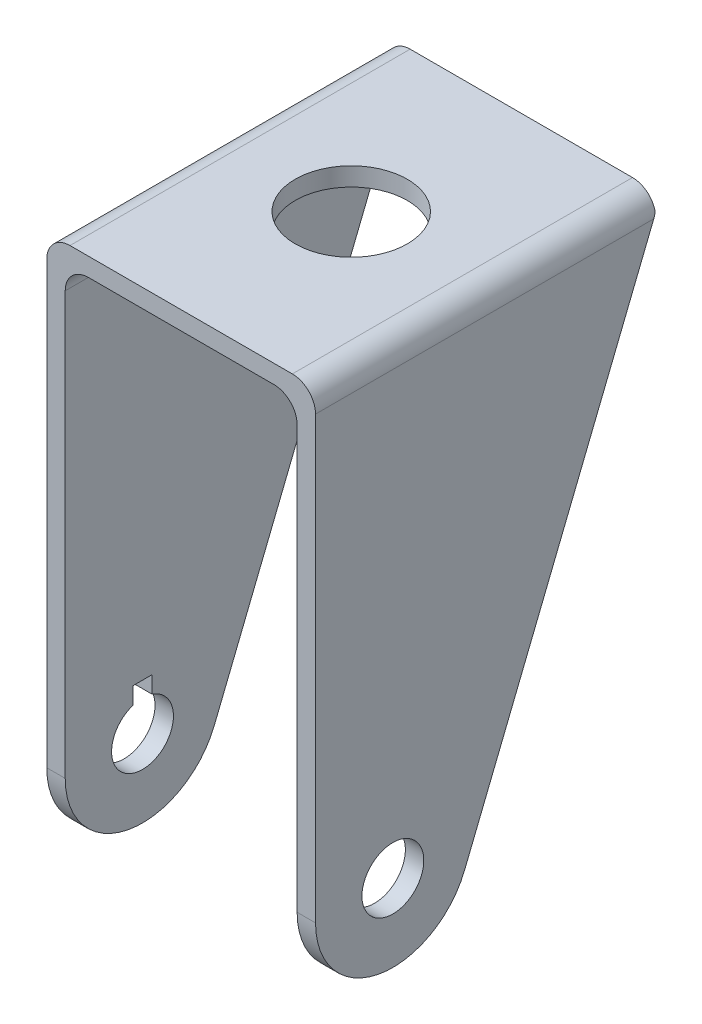
from build123d import *

# Parameters (mm, degrees)
TOP_DEPTH      = 10
TOP_DEPTH_BACK = 34
SKETCH1_W      = 30
SKETCH1_H      = 2.38125
SKETCH2_R      = 10
SKETCH2_R_2    = 4
SKETCH2_W      = 44
SKETCH2_H      = 2.38125
SIDE_DEPTH     = 2.38125
TOP_FILLETS_R  = 3
SKETCH3_R      = 7.25
TOP_HOLE_DEPTH = 80.737744209
KEYWAY_REACH   = 79.23
SKETCH4_W      = 2.5
SKETCH4_H      = 6


with BuildPart() as part:
    # Sketch1 → Top (new, two sides: drawn at the far end of the back side and taken through both)
    with BuildSketch(Plane.XY.offset(-TOP_DEPTH_BACK)):
        with Locations((0, 58.809375)):
            Rectangle(SKETCH1_W, SKETCH1_H)
    extrude(amount=TOP_DEPTH + TOP_DEPTH_BACK)

    # Sketch2 → Side (add)
    # profile 1 of 3: a face of its own
    with BuildSketch(Plane(origin=(15, 0, 0), x_dir=(0, 0, -1), z_dir=(1, 0, 0))):
        with BuildLine():
            Line((34, 57.61875), (-10, 57.61875))
            Line((-10, 57.61875), (-10, 0))
            ThreePointArc((-10, 0), (0, 10), (10, 0))
            ThreePointArc((10, 0), (9.817137723, -1.903629934), (9.275238615, -3.737639447))
            Line((9.275238615, -3.737639447), (34, 57.61875))
        make_face()
    # profile 2 of 3: a face of its own
    with BuildSketch(Plane(origin=(15, 0, 0), x_dir=(0, 0, -1), z_dir=(1, 0, 0))):
        Circle(SKETCH2_R)
        with Locations(Location((0, 0, 0), (0, 0, 180))):
            Circle(SKETCH2_R_2, mode=Mode.SUBTRACT)
    # profile 3 of 3: a face of its own
    with BuildSketch(Plane(origin=(15, 0, 0), x_dir=(0, 0, -1), z_dir=(1, 0, 0))):
        with Locations((12, 58.809375)):
            Rectangle(SKETCH2_W, SKETCH2_H)
    side = extrude(amount=SIDE_DEPTH)

    # Side Mirror: Side across plane
    add(side.mirror(Plane(origin=(0, 0, 0), x_dir=(0, 0, 1), z_dir=(1, 0, 0))))

    # Top Fillets
    top_fillets_edges = [part.edges().sort_by_distance(p)[0] for p in [
        (17.38125, 60, -12),
        (-17.38125, 60, -12),
        (15, 57.61875, -12),
        (-15, 57.61875, -12),
    ]]
    fillet(top_fillets_edges, radius=TOP_FILLETS_R)

    # Sketch3 → Top Hole (cut, through all)
    with BuildSketch(Plane(origin=(0, 60, 0), x_dir=(1, 0, 0), z_dir=(0, 1, 0))):
        with Locations(Location((0, 12, 0), (0, 0, 270))):
            Circle(SKETCH3_R)
    extrude(amount=-TOP_HOLE_DEPTH, mode=Mode.SUBTRACT)

    # Sketch4 → Keyway (cut, up to next)
    with BuildSketch(Plane.ZY.offset(17.38125), mode=Mode.PRIVATE) as keyway_sk1:
        with Locations((0, 3)):
            Rectangle(SKETCH4_W, SKETCH4_H)
    keyway_tool1 = extrude(keyway_sk1.sketch, amount=-KEYWAY_REACH, mode=Mode.PRIVATE) & part.part
    add(keyway_tool1.solids().sort_by_distance((-17.38125, 3, 0))[0], mode=Mode.SUBTRACT)


solid = part.part
